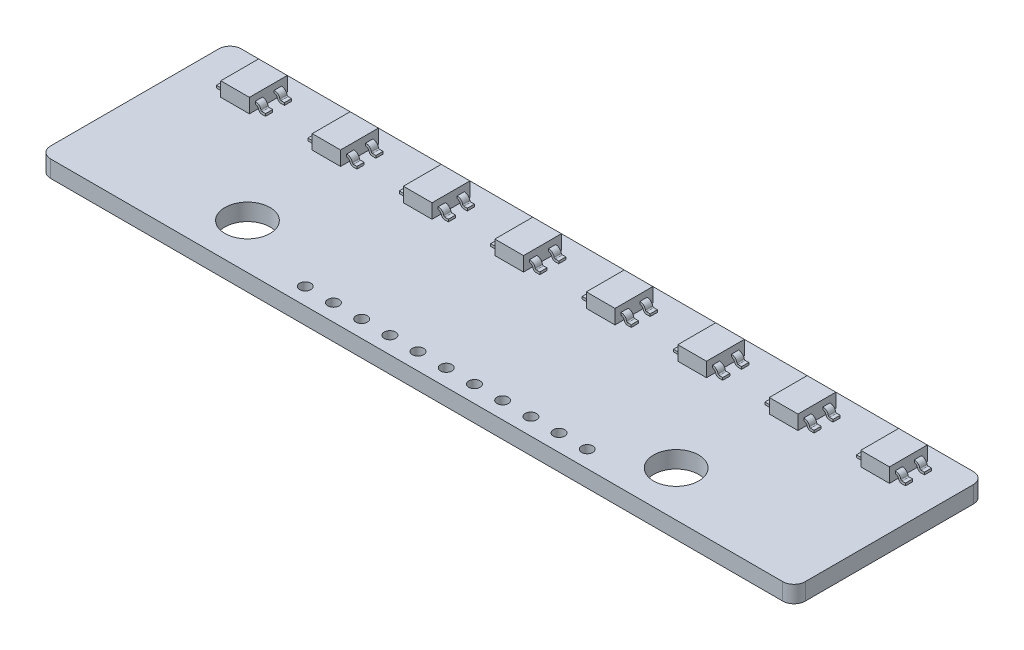
from build123d import *

# Parameters (mm, degrees)
SKETCH_1_R                     = 2
SKETCH_1_R_2                   = 0.5
EXTRUDE_1_DEPTH                = 0.75
SKETCH_4_W                     = 2.54
SKETCH_4_H                     = 3.36
EXTRUDE_2_DEPTH                = 1.27
SKETCH_4_W_2                   = 2.51
EXTRUDE_2_2_DEPTH              = 1.27
EXTRUDE_2_3_DEPTH              = 1.27
EXTRUDE_2_4_DEPTH              = 1.27
EXTRUDE_2_5_DEPTH              = 1.27
EXTRUDE_2_6_DEPTH              = 1.27
EXTRUDE_2_7_DEPTH              = 1.27
EXTRUDE_2_8_DEPTH              = 1.27
EXTRUDE_3_DEPTH                = 0.3175
EXTRUDE_3_2_DEPTH              = 0.3175
PATTERN_LINEAR_3_COUNT         = 8
PATTERN_LINEAR_3_PITCH         = 8.105
PATTERN_LINEAR_3_COPY_1_DEPTH  = 0.3175
PATTERN_LINEAR_3_COPY_2_DEPTH  = 0.3175
PATTERN_LINEAR_3_COPY_3_DEPTH  = 0.3175
PATTERN_LINEAR_3_COPY_4_DEPTH  = 0.3175
PATTERN_LINEAR_3_COPY_5_DEPTH  = 0.3175
PATTERN_LINEAR_3_COPY_6_DEPTH  = 0.3175
PATTERN_LINEAR_3_COPY_7_DEPTH  = 0.3175
PATTERN_LINEAR_3_COPY_8_DEPTH  = 0.3175
PATTERN_LINEAR_3_COPY_9_DEPTH  = 0.3175
PATTERN_LINEAR_3_COPY_10_DEPTH = 0.3175
PATTERN_LINEAR_3_COPY_11_DEPTH = 0.3175
PATTERN_LINEAR_3_COPY_12_DEPTH = 0.3175
PATTERN_LINEAR_3_COPY_13_DEPTH = 0.3175
PATTERN_LINEAR_3_COPY_14_DEPTH = 0.3175
PATTERN_LINEAR_3_COPY_15_DEPTH = 0.3175
PATTERN_LINEAR_3_COPY_16_DEPTH = 0.3175
PATTERN_LINEAR_3_COPY_17_DEPTH = 0.3175
PATTERN_LINEAR_3_COPY_18_DEPTH = 0.3175
PATTERN_LINEAR_3_COPY_19_DEPTH = 0.3175
PATTERN_LINEAR_3_COPY_20_DEPTH = 0.3175
PATTERN_LINEAR_3_COPY_21_DEPTH = 0.3175


with BuildPart() as part:
    # Эскиз1 → Бобышка-Вытянуть1 (new, symmetric)
    with BuildSketch(Plane(origin=(0, 0, 0), x_dir=(1, 0, 0), z_dir=(0, 1, 0))):
        with BuildLine():
            Line((32.45, -8.45), (-32.45, -8.45))
            ThreePointArc((-32.45, -8.45), (-33.157106781, -8.157106781), (-33.45, -7.45))
            Line((-33.45, -7.45), (-33.45, 7.45))
            ThreePointArc((-33.45, 7.45), (-33.157106781, 8.157106781), (-32.45, 8.45))
            Line((-32.45, 8.45), (32.45, 8.45))
            ThreePointArc((32.45, 8.45), (33.157106781, 8.157106781), (33.45, 7.45))
            Line((33.45, 7.45), (33.45, -7.45))
            ThreePointArc((33.45, -7.45), (33.157106781, -8.157106781), (32.45, -8.45))
        make_face()
        with Locations(Location((-19, -4.45, 0), (0, 0, 270))):
            Circle(SKETCH_1_R, mode=Mode.SUBTRACT)
        with Locations(Location((19, -4.45, 0), (0, 0, 270))):
            Circle(SKETCH_1_R, mode=Mode.SUBTRACT)
        with Locations(Location((-11.378949596, -6.95, 0), (0, 0, 270))):
            Circle(SKETCH_1_R_2, mode=Mode.SUBTRACT)
        with Locations(Location((-8.878949596, -6.95, 0), (0, 0, 270))):
            Circle(SKETCH_1_R_2, mode=Mode.SUBTRACT)
        with Locations(Location((-6.378949596, -6.95, 0), (0, 0, 270))):
            Circle(SKETCH_1_R_2, mode=Mode.SUBTRACT)
        with Locations(Location((-3.878949596, -6.95, 0), (0, 0, 270))):
            Circle(SKETCH_1_R_2, mode=Mode.SUBTRACT)
        with Locations(Location((-1.378949596, -6.95, 0), (0, 0, 270))):
            Circle(SKETCH_1_R_2, mode=Mode.SUBTRACT)
        with Locations(Location((1.121050404, -6.95, 0), (0, 0, 270))):
            Circle(SKETCH_1_R_2, mode=Mode.SUBTRACT)
        with Locations(Location((3.621050404, -6.95, 0), (0, 0, 270))):
            Circle(SKETCH_1_R_2, mode=Mode.SUBTRACT)
        with Locations(Location((6.121050404, -6.95, 0), (0, 0, 270))):
            Circle(SKETCH_1_R_2, mode=Mode.SUBTRACT)
        with Locations(Location((8.621050404, -6.95, 0), (0, 0, 270))):
            Circle(SKETCH_1_R_2, mode=Mode.SUBTRACT)
        with Locations(Location((11.121050404, -6.95, 0), (0, 0, 270))):
            Circle(SKETCH_1_R_2, mode=Mode.SUBTRACT)
        with Locations(Location((13.621050404, -6.95, 0), (0, 0, 270))):
            Circle(SKETCH_1_R_2, mode=Mode.SUBTRACT)
    extrude(amount=EXTRUDE_1_DEPTH, both=True)


with BuildPart() as body_2:
    # Эскиз4 → Бобышка-Вытянуть2 (new body)
    with BuildSketch(Plane(origin=(0, 0.75, 0), x_dir=(1, 0, 0), z_dir=(0, 1, 0))):
        with Locations((-28.37, 5.5)):
            Rectangle(SKETCH_4_W, SKETCH_4_H)
    extrude(amount=EXTRUDE_2_DEPTH)


with BuildPart() as body_3:
    # Эскиз4 → Extrude 2 2 (new body)
    with BuildSketch(Plane(origin=(0, 0.75, 0), x_dir=(1, 0, 0), z_dir=(0, 1, 0))):
        with Locations((-20.275, 5.5)):
            Rectangle(SKETCH_4_W_2, SKETCH_4_H)
    extrude(amount=EXTRUDE_2_2_DEPTH)


with BuildPart() as body_4:
    # Эскиз4 → Extrude 2 3 (new body)
    with BuildSketch(Plane(origin=(0, 0.75, 0), x_dir=(1, 0, 0), z_dir=(0, 1, 0))):
        with Locations((-12.18, 5.5)):
            Rectangle(SKETCH_4_W, SKETCH_4_H)
    extrude(amount=EXTRUDE_2_3_DEPTH)


with BuildPart() as body_5:
    # Эскиз4 → Extrude 2 4 (new body)
    with BuildSketch(Plane(origin=(0, 0.75, 0), x_dir=(1, 0, 0), z_dir=(0, 1, 0))):
        with Locations((-4.07, 5.5)):
            Rectangle(SKETCH_4_W, SKETCH_4_H)
    extrude(amount=EXTRUDE_2_4_DEPTH)


with BuildPart() as body_6:
    # Эскиз4 → Extrude 2 5 (new body)
    with BuildSketch(Plane(origin=(0, 0.75, 0), x_dir=(1, 0, 0), z_dir=(0, 1, 0))):
        with Locations((4.04, 5.5)):
            Rectangle(SKETCH_4_W, SKETCH_4_H)
    extrude(amount=EXTRUDE_2_5_DEPTH)


with BuildPart() as body_7:
    # Эскиз4 → Extrude 2 6 (new body)
    with BuildSketch(Plane(origin=(0, 0.75, 0), x_dir=(1, 0, 0), z_dir=(0, 1, 0))):
        with Locations((12.15, 5.5)):
            Rectangle(SKETCH_4_W, SKETCH_4_H)
    extrude(amount=EXTRUDE_2_6_DEPTH)


with BuildPart() as body_8:
    # Эскиз4 → Extrude 2 7 (new body)
    with BuildSketch(Plane(origin=(0, 0.75, 0), x_dir=(1, 0, 0), z_dir=(0, 1, 0))):
        with Locations((20.26, 5.5)):
            Rectangle(SKETCH_4_W, SKETCH_4_H)
    extrude(amount=EXTRUDE_2_7_DEPTH)


with BuildPart() as body_9:
    # Эскиз4 → Extrude 2 8 (new body)
    with BuildSketch(Plane(origin=(0, 0.75, 0), x_dir=(1, 0, 0), z_dir=(0, 1, 0))):
        with Locations((28.37, 5.5)):
            Rectangle(SKETCH_4_W, SKETCH_4_H)
    extrude(amount=EXTRUDE_2_8_DEPTH)


with BuildPart() as body_10:
    # Эскиз5 → Бобышка-Вытянуть3 (new, symmetric)
    with BuildSketch(Plane(origin=(0, 0, -6.34), x_dir=(-1, 0, 0), z_dir=(0, 0, -1))):
        with BuildLine():
            Line((29.64, 1.458292125), (29.64, 1.25))
            ThreePointArc((29.64, 1.25), (29.826821836, 1.163474695), (29.932521974, 0.986792755))
            ThreePointArc((29.932521974, 0.986792755), (30.042505646, 0.816264572), (30.234300526, 0.75))
            Line((30.234300526, 0.75), (30.547186473, 0.75))
            Line((30.547186473, 0.75), (30.547186473, 0.96))
            Line((30.547186473, 0.96), (30.234300526, 0.96))
            ThreePointArc((30.234300526, 0.96), (30.169603768, 0.983533756), (30.135147702, 1.043134827))
            ThreePointArc((30.135147702, 1.043134827), (29.96308158, 1.340769651), (29.64, 1.458292125))
        make_face()
    extrude_3 = extrude(amount=EXTRUDE_3_DEPTH, both=True)


with BuildPart() as body_11:
    # Эскиз5 → Extrude 3 2 (new, symmetric)
    with BuildSketch(Plane(origin=(0, 0, -6.34), x_dir=(-1, 0, 0), z_dir=(0, 0, -1))):
        with BuildLine():
            Line((26.192813527, 0.96), (26.505699474, 0.96))
            ThreePointArc((26.505699474, 0.96), (26.570396232, 0.983533756), (26.604852298, 1.043134827))
            ThreePointArc((26.604852298, 1.043134827), (26.77691842, 1.340769651), (27.1, 1.458292125))
            Line((27.1, 1.458292125), (27.1, 1.25))
            ThreePointArc((27.1, 1.25), (26.913178164, 1.163474695), (26.807478026, 0.986792755))
            ThreePointArc((26.807478026, 0.986792755), (26.697494354, 0.816264572), (26.505699474, 0.75))
            Line((26.505699474, 0.75), (26.192813527, 0.75))
            Line((26.192813527, 0.75), (26.192813527, 0.96))
        make_face()
    extrude_3_2 = extrude(amount=EXTRUDE_3_2_DEPTH, both=True)


with BuildPart() as part_1:
    add(part.part)

    add(body_2.part)  # Зеркальное отражение1 merges body 2
    # Зеркальное отражение1: Бобышка-Вытянуть3, Extrude 3 2 across plane
    add(extrude_3.mirror(Plane(origin=(0, 0, -5.5), x_dir=(1, 0, 0), z_dir=(0, 0, -1))))
    add(extrude_3_2.mirror(Plane(origin=(0, 0, -5.5), x_dir=(1, 0, 0), z_dir=(0, 0, -1))))

    add(body_4.part)  # Линейный массив3 merges body 4

    add(body_5.part)  # Линейный массив3 merges body 5

    add(body_6.part)  # Линейный массив3 merges body 6

    add(body_7.part)  # Линейный массив3 merges body 7

    add(body_8.part)  # Линейный массив3 merges body 8

    add(body_9.part)  # Линейный массив3 merges body 9
    # Линейный массив3: Бобышка-Вытянуть3, Extrude 3 2 ×8
    with Locations(*[(i * PATTERN_LINEAR_3_PITCH, 0, 0) for i in range(1, PATTERN_LINEAR_3_COUNT)]):
        add(extrude_3)
        add(extrude_3_2)

    # Линейный массив3 copy 1 sketch → Линейный массив3 copy 1 (add, symmetric)
    with BuildSketch(Plane(origin=(8.105, 0, -4.66), x_dir=(-1, 0, 0), z_dir=(0, 0, 1))):
        with BuildLine():
            Line((29.64, -1.458292125), (29.64, -1.25))
            ThreePointArc((29.64, -1.25), (29.826821836, -1.163474695), (29.932521974, -0.986792755))
            ThreePointArc((29.932521974, -0.986792755), (30.042505646, -0.816264572), (30.234300526, -0.75))
            Line((30.234300526, -0.75), (30.547186473, -0.75))
            Line((30.547186473, -0.75), (30.547186473, -0.96))
            Line((30.547186473, -0.96), (30.234300526, -0.96))
            ThreePointArc((30.234300526, -0.96), (30.169603768, -0.983533756), (30.135147702, -1.043134827))
            ThreePointArc((30.135147702, -1.043134827), (29.96308158, -1.340769651), (29.64, -1.458292125))
        make_face()
    extrude(amount=PATTERN_LINEAR_3_COPY_1_DEPTH, both=True)

    # Линейный массив3 copy 2 sketch → Линейный массив3 copy 2 (add, symmetric)
    with BuildSketch(Plane(origin=(16.21, 0, -4.66), x_dir=(-1, 0, 0), z_dir=(0, 0, 1))):
        with BuildLine():
            Line((29.64, -1.458292125), (29.64, -1.25))
            ThreePointArc((29.64, -1.25), (29.826821836, -1.163474695), (29.932521974, -0.986792755))
            ThreePointArc((29.932521974, -0.986792755), (30.042505646, -0.816264572), (30.234300526, -0.75))
            Line((30.234300526, -0.75), (30.547186473, -0.75))
            Line((30.547186473, -0.75), (30.547186473, -0.96))
            Line((30.547186473, -0.96), (30.234300526, -0.96))
            ThreePointArc((30.234300526, -0.96), (30.169603768, -0.983533756), (30.135147702, -1.043134827))
            ThreePointArc((30.135147702, -1.043134827), (29.96308158, -1.340769651), (29.64, -1.458292125))
        make_face()
    extrude(amount=PATTERN_LINEAR_3_COPY_2_DEPTH, both=True)

    # Линейный массив3 copy 3 sketch → Линейный массив3 copy 3 (add, symmetric)
    with BuildSketch(Plane(origin=(24.315, 0, -4.66), x_dir=(-1, 0, 0), z_dir=(0, 0, 1))):
        with BuildLine():
            Line((29.64, -1.458292125), (29.64, -1.25))
            ThreePointArc((29.64, -1.25), (29.826821836, -1.163474695), (29.932521974, -0.986792755))
            ThreePointArc((29.932521974, -0.986792755), (30.042505646, -0.816264572), (30.234300526, -0.75))
            Line((30.234300526, -0.75), (30.547186473, -0.75))
            Line((30.547186473, -0.75), (30.547186473, -0.96))
            Line((30.547186473, -0.96), (30.234300526, -0.96))
            ThreePointArc((30.234300526, -0.96), (30.169603768, -0.983533756), (30.135147702, -1.043134827))
            ThreePointArc((30.135147702, -1.043134827), (29.96308158, -1.340769651), (29.64, -1.458292125))
        make_face()
    extrude(amount=PATTERN_LINEAR_3_COPY_3_DEPTH, both=True)

    # Линейный массив3 copy 4 sketch → Линейный массив3 copy 4 (add, symmetric)
    with BuildSketch(Plane(origin=(32.42, 0, -4.66), x_dir=(-1, 0, 0), z_dir=(0, 0, 1))):
        with BuildLine():
            Line((29.64, -1.458292125), (29.64, -1.25))
            ThreePointArc((29.64, -1.25), (29.826821836, -1.163474695), (29.932521974, -0.986792755))
            ThreePointArc((29.932521974, -0.986792755), (30.042505646, -0.816264572), (30.234300526, -0.75))
            Line((30.234300526, -0.75), (30.547186473, -0.75))
            Line((30.547186473, -0.75), (30.547186473, -0.96))
            Line((30.547186473, -0.96), (30.234300526, -0.96))
            ThreePointArc((30.234300526, -0.96), (30.169603768, -0.983533756), (30.135147702, -1.043134827))
            ThreePointArc((30.135147702, -1.043134827), (29.96308158, -1.340769651), (29.64, -1.458292125))
        make_face()
    extrude(amount=PATTERN_LINEAR_3_COPY_4_DEPTH, both=True)

    # Линейный массив3 copy 5 sketch → Линейный массив3 copy 5 (add, symmetric)
    with BuildSketch(Plane(origin=(40.525, 0, -4.66), x_dir=(-1, 0, 0), z_dir=(0, 0, 1))):
        with BuildLine():
            Line((29.64, -1.458292125), (29.64, -1.25))
            ThreePointArc((29.64, -1.25), (29.826821836, -1.163474695), (29.932521974, -0.986792755))
            ThreePointArc((29.932521974, -0.986792755), (30.042505646, -0.816264572), (30.234300526, -0.75))
            Line((30.234300526, -0.75), (30.547186473, -0.75))
            Line((30.547186473, -0.75), (30.547186473, -0.96))
            Line((30.547186473, -0.96), (30.234300526, -0.96))
            ThreePointArc((30.234300526, -0.96), (30.169603768, -0.983533756), (30.135147702, -1.043134827))
            ThreePointArc((30.135147702, -1.043134827), (29.96308158, -1.340769651), (29.64, -1.458292125))
        make_face()
    extrude(amount=PATTERN_LINEAR_3_COPY_5_DEPTH, both=True)

    # Линейный массив3 copy 6 sketch → Линейный массив3 copy 6 (add, symmetric)
    with BuildSketch(Plane(origin=(48.63, 0, -4.66), x_dir=(-1, 0, 0), z_dir=(0, 0, 1))):
        with BuildLine():
            Line((29.64, -1.458292125), (29.64, -1.25))
            ThreePointArc((29.64, -1.25), (29.826821836, -1.163474695), (29.932521974, -0.986792755))
            ThreePointArc((29.932521974, -0.986792755), (30.042505646, -0.816264572), (30.234300526, -0.75))
            Line((30.234300526, -0.75), (30.547186473, -0.75))
            Line((30.547186473, -0.75), (30.547186473, -0.96))
            Line((30.547186473, -0.96), (30.234300526, -0.96))
            ThreePointArc((30.234300526, -0.96), (30.169603768, -0.983533756), (30.135147702, -1.043134827))
            ThreePointArc((30.135147702, -1.043134827), (29.96308158, -1.340769651), (29.64, -1.458292125))
        make_face()
    extrude(amount=PATTERN_LINEAR_3_COPY_6_DEPTH, both=True)

    # Линейный массив3 copy 7 sketch → Линейный массив3 copy 7 (add, symmetric)
    with BuildSketch(Plane(origin=(56.735, 0, -4.66), x_dir=(-1, 0, 0), z_dir=(0, 0, 1))):
        with BuildLine():
            Line((29.64, -1.458292125), (29.64, -1.25))
            ThreePointArc((29.64, -1.25), (29.826821836, -1.163474695), (29.932521974, -0.986792755))
            ThreePointArc((29.932521974, -0.986792755), (30.042505646, -0.816264572), (30.234300526, -0.75))
            Line((30.234300526, -0.75), (30.547186473, -0.75))
            Line((30.547186473, -0.75), (30.547186473, -0.96))
            Line((30.547186473, -0.96), (30.234300526, -0.96))
            ThreePointArc((30.234300526, -0.96), (30.169603768, -0.983533756), (30.135147702, -1.043134827))
            ThreePointArc((30.135147702, -1.043134827), (29.96308158, -1.340769651), (29.64, -1.458292125))
        make_face()
    extrude(amount=PATTERN_LINEAR_3_COPY_7_DEPTH, both=True)

    # Линейный массив3 copy 8 sketch → Линейный массив3 copy 8 (add, symmetric)
    with BuildSketch(Plane(origin=(8.105, 0, -4.66), x_dir=(-1, 0, 0), z_dir=(0, 0, 1))):
        with BuildLine():
            Line((26.192813527, -0.96), (26.505699474, -0.96))
            ThreePointArc((26.505699474, -0.96), (26.570396232, -0.983533756), (26.604852298, -1.043134827))
            ThreePointArc((26.604852298, -1.043134827), (26.77691842, -1.340769651), (27.1, -1.458292125))
            Line((27.1, -1.458292125), (27.1, -1.25))
            ThreePointArc((27.1, -1.25), (26.913178164, -1.163474695), (26.807478026, -0.986792755))
            ThreePointArc((26.807478026, -0.986792755), (26.697494354, -0.816264572), (26.505699474, -0.75))
            Line((26.505699474, -0.75), (26.192813527, -0.75))
            Line((26.192813527, -0.75), (26.192813527, -0.96))
        make_face()
    extrude(amount=PATTERN_LINEAR_3_COPY_8_DEPTH, both=True)

    # Линейный массив3 copy 9 sketch → Линейный массив3 copy 9 (add, symmetric)
    with BuildSketch(Plane(origin=(16.21, 0, -4.66), x_dir=(-1, 0, 0), z_dir=(0, 0, 1))):
        with BuildLine():
            Line((26.192813527, -0.96), (26.505699474, -0.96))
            ThreePointArc((26.505699474, -0.96), (26.570396232, -0.983533756), (26.604852298, -1.043134827))
            ThreePointArc((26.604852298, -1.043134827), (26.77691842, -1.340769651), (27.1, -1.458292125))
            Line((27.1, -1.458292125), (27.1, -1.25))
            ThreePointArc((27.1, -1.25), (26.913178164, -1.163474695), (26.807478026, -0.986792755))
            ThreePointArc((26.807478026, -0.986792755), (26.697494354, -0.816264572), (26.505699474, -0.75))
            Line((26.505699474, -0.75), (26.192813527, -0.75))
            Line((26.192813527, -0.75), (26.192813527, -0.96))
        make_face()
    extrude(amount=PATTERN_LINEAR_3_COPY_9_DEPTH, both=True)

    # Линейный массив3 copy 10 sketch → Линейный массив3 copy 10 (add, symmetric)
    with BuildSketch(Plane(origin=(24.315, 0, -4.66), x_dir=(-1, 0, 0), z_dir=(0, 0, 1))):
        with BuildLine():
            Line((26.192813527, -0.96), (26.505699474, -0.96))
            ThreePointArc((26.505699474, -0.96), (26.570396232, -0.983533756), (26.604852298, -1.043134827))
            ThreePointArc((26.604852298, -1.043134827), (26.77691842, -1.340769651), (27.1, -1.458292125))
            Line((27.1, -1.458292125), (27.1, -1.25))
            ThreePointArc((27.1, -1.25), (26.913178164, -1.163474695), (26.807478026, -0.986792755))
            ThreePointArc((26.807478026, -0.986792755), (26.697494354, -0.816264572), (26.505699474, -0.75))
            Line((26.505699474, -0.75), (26.192813527, -0.75))
            Line((26.192813527, -0.75), (26.192813527, -0.96))
        make_face()
    extrude(amount=PATTERN_LINEAR_3_COPY_10_DEPTH, both=True)

    # Линейный массив3 copy 11 sketch → Линейный массив3 copy 11 (add, symmetric)
    with BuildSketch(Plane(origin=(32.42, 0, -4.66), x_dir=(-1, 0, 0), z_dir=(0, 0, 1))):
        with BuildLine():
            Line((26.192813527, -0.96), (26.505699474, -0.96))
            ThreePointArc((26.505699474, -0.96), (26.570396232, -0.983533756), (26.604852298, -1.043134827))
            ThreePointArc((26.604852298, -1.043134827), (26.77691842, -1.340769651), (27.1, -1.458292125))
            Line((27.1, -1.458292125), (27.1, -1.25))
            ThreePointArc((27.1, -1.25), (26.913178164, -1.163474695), (26.807478026, -0.986792755))
            ThreePointArc((26.807478026, -0.986792755), (26.697494354, -0.816264572), (26.505699474, -0.75))
            Line((26.505699474, -0.75), (26.192813527, -0.75))
            Line((26.192813527, -0.75), (26.192813527, -0.96))
        make_face()
    extrude(amount=PATTERN_LINEAR_3_COPY_11_DEPTH, both=True)

    # Линейный массив3 copy 12 sketch → Линейный массив3 copy 12 (add, symmetric)
    with BuildSketch(Plane(origin=(40.525, 0, -4.66), x_dir=(-1, 0, 0), z_dir=(0, 0, 1))):
        with BuildLine():
            Line((26.192813527, -0.96), (26.505699474, -0.96))
            ThreePointArc((26.505699474, -0.96), (26.570396232, -0.983533756), (26.604852298, -1.043134827))
            ThreePointArc((26.604852298, -1.043134827), (26.77691842, -1.340769651), (27.1, -1.458292125))
            Line((27.1, -1.458292125), (27.1, -1.25))
            ThreePointArc((27.1, -1.25), (26.913178164, -1.163474695), (26.807478026, -0.986792755))
            ThreePointArc((26.807478026, -0.986792755), (26.697494354, -0.816264572), (26.505699474, -0.75))
            Line((26.505699474, -0.75), (26.192813527, -0.75))
            Line((26.192813527, -0.75), (26.192813527, -0.96))
        make_face()
    extrude(amount=PATTERN_LINEAR_3_COPY_12_DEPTH, both=True)

    # Линейный массив3 copy 13 sketch → Линейный массив3 copy 13 (add, symmetric)
    with BuildSketch(Plane(origin=(48.63, 0, -4.66), x_dir=(-1, 0, 0), z_dir=(0, 0, 1))):
        with BuildLine():
            Line((26.192813527, -0.96), (26.505699474, -0.96))
            ThreePointArc((26.505699474, -0.96), (26.570396232, -0.983533756), (26.604852298, -1.043134827))
            ThreePointArc((26.604852298, -1.043134827), (26.77691842, -1.340769651), (27.1, -1.458292125))
            Line((27.1, -1.458292125), (27.1, -1.25))
            ThreePointArc((27.1, -1.25), (26.913178164, -1.163474695), (26.807478026, -0.986792755))
            ThreePointArc((26.807478026, -0.986792755), (26.697494354, -0.816264572), (26.505699474, -0.75))
            Line((26.505699474, -0.75), (26.192813527, -0.75))
            Line((26.192813527, -0.75), (26.192813527, -0.96))
        make_face()
    extrude(amount=PATTERN_LINEAR_3_COPY_13_DEPTH, both=True)

    # Линейный массив3 copy 14 sketch → Линейный массив3 copy 14 (add, symmetric)
    with BuildSketch(Plane(origin=(56.735, 0, -4.66), x_dir=(-1, 0, 0), z_dir=(0, 0, 1))):
        with BuildLine():
            Line((26.192813527, -0.96), (26.505699474, -0.96))
            ThreePointArc((26.505699474, -0.96), (26.570396232, -0.983533756), (26.604852298, -1.043134827))
            ThreePointArc((26.604852298, -1.043134827), (26.77691842, -1.340769651), (27.1, -1.458292125))
            Line((27.1, -1.458292125), (27.1, -1.25))
            ThreePointArc((27.1, -1.25), (26.913178164, -1.163474695), (26.807478026, -0.986792755))
            ThreePointArc((26.807478026, -0.986792755), (26.697494354, -0.816264572), (26.505699474, -0.75))
            Line((26.505699474, -0.75), (26.192813527, -0.75))
            Line((26.192813527, -0.75), (26.192813527, -0.96))
        make_face()
    extrude(amount=PATTERN_LINEAR_3_COPY_14_DEPTH, both=True)

    # Линейный массив3 copy 15 sketch → Линейный массив3 copy 15 (add, symmetric)
    with BuildSketch(Plane(origin=(8.105, 0, -6.34), x_dir=(-1, 0, 0), z_dir=(0, 0, -1))):
        with BuildLine():
            Line((26.192813527, 0.96), (26.505699474, 0.96))
            ThreePointArc((26.505699474, 0.96), (26.570396232, 0.983533756), (26.604852298, 1.043134827))
            ThreePointArc((26.604852298, 1.043134827), (26.77691842, 1.340769651), (27.1, 1.458292125))
            Line((27.1, 1.458292125), (27.1, 1.25))
            ThreePointArc((27.1, 1.25), (26.913178164, 1.163474695), (26.807478026, 0.986792755))
            ThreePointArc((26.807478026, 0.986792755), (26.697494354, 0.816264572), (26.505699474, 0.75))
            Line((26.505699474, 0.75), (26.192813527, 0.75))
            Line((26.192813527, 0.75), (26.192813527, 0.96))
        make_face()
    extrude(amount=PATTERN_LINEAR_3_COPY_15_DEPTH, both=True)

    # Линейный массив3 copy 16 sketch → Линейный массив3 copy 16 (add, symmetric)
    with BuildSketch(Plane(origin=(16.21, 0, -6.34), x_dir=(-1, 0, 0), z_dir=(0, 0, -1))):
        with BuildLine():
            Line((26.192813527, 0.96), (26.505699474, 0.96))
            ThreePointArc((26.505699474, 0.96), (26.570396232, 0.983533756), (26.604852298, 1.043134827))
            ThreePointArc((26.604852298, 1.043134827), (26.77691842, 1.340769651), (27.1, 1.458292125))
            Line((27.1, 1.458292125), (27.1, 1.25))
            ThreePointArc((27.1, 1.25), (26.913178164, 1.163474695), (26.807478026, 0.986792755))
            ThreePointArc((26.807478026, 0.986792755), (26.697494354, 0.816264572), (26.505699474, 0.75))
            Line((26.505699474, 0.75), (26.192813527, 0.75))
            Line((26.192813527, 0.75), (26.192813527, 0.96))
        make_face()
    extrude(amount=PATTERN_LINEAR_3_COPY_16_DEPTH, both=True)

    # Линейный массив3 copy 17 sketch → Линейный массив3 copy 17 (add, symmetric)
    with BuildSketch(Plane(origin=(24.315, 0, -6.34), x_dir=(-1, 0, 0), z_dir=(0, 0, -1))):
        with BuildLine():
            Line((26.192813527, 0.96), (26.505699474, 0.96))
            ThreePointArc((26.505699474, 0.96), (26.570396232, 0.983533756), (26.604852298, 1.043134827))
            ThreePointArc((26.604852298, 1.043134827), (26.77691842, 1.340769651), (27.1, 1.458292125))
            Line((27.1, 1.458292125), (27.1, 1.25))
            ThreePointArc((27.1, 1.25), (26.913178164, 1.163474695), (26.807478026, 0.986792755))
            ThreePointArc((26.807478026, 0.986792755), (26.697494354, 0.816264572), (26.505699474, 0.75))
            Line((26.505699474, 0.75), (26.192813527, 0.75))
            Line((26.192813527, 0.75), (26.192813527, 0.96))
        make_face()
    extrude(amount=PATTERN_LINEAR_3_COPY_17_DEPTH, both=True)

    # Линейный массив3 copy 18 sketch → Линейный массив3 copy 18 (add, symmetric)
    with BuildSketch(Plane(origin=(32.42, 0, -6.34), x_dir=(-1, 0, 0), z_dir=(0, 0, -1))):
        with BuildLine():
            Line((26.192813527, 0.96), (26.505699474, 0.96))
            ThreePointArc((26.505699474, 0.96), (26.570396232, 0.983533756), (26.604852298, 1.043134827))
            ThreePointArc((26.604852298, 1.043134827), (26.77691842, 1.340769651), (27.1, 1.458292125))
            Line((27.1, 1.458292125), (27.1, 1.25))
            ThreePointArc((27.1, 1.25), (26.913178164, 1.163474695), (26.807478026, 0.986792755))
            ThreePointArc((26.807478026, 0.986792755), (26.697494354, 0.816264572), (26.505699474, 0.75))
            Line((26.505699474, 0.75), (26.192813527, 0.75))
            Line((26.192813527, 0.75), (26.192813527, 0.96))
        make_face()
    extrude(amount=PATTERN_LINEAR_3_COPY_18_DEPTH, both=True)

    # Линейный массив3 copy 19 sketch → Линейный массив3 copy 19 (add, symmetric)
    with BuildSketch(Plane(origin=(40.525, 0, -6.34), x_dir=(-1, 0, 0), z_dir=(0, 0, -1))):
        with BuildLine():
            Line((26.192813527, 0.96), (26.505699474, 0.96))
            ThreePointArc((26.505699474, 0.96), (26.570396232, 0.983533756), (26.604852298, 1.043134827))
            ThreePointArc((26.604852298, 1.043134827), (26.77691842, 1.340769651), (27.1, 1.458292125))
            Line((27.1, 1.458292125), (27.1, 1.25))
            ThreePointArc((27.1, 1.25), (26.913178164, 1.163474695), (26.807478026, 0.986792755))
            ThreePointArc((26.807478026, 0.986792755), (26.697494354, 0.816264572), (26.505699474, 0.75))
            Line((26.505699474, 0.75), (26.192813527, 0.75))
            Line((26.192813527, 0.75), (26.192813527, 0.96))
        make_face()
    extrude(amount=PATTERN_LINEAR_3_COPY_19_DEPTH, both=True)

    # Линейный массив3 copy 20 sketch → Линейный массив3 copy 20 (add, symmetric)
    with BuildSketch(Plane(origin=(48.63, 0, -6.34), x_dir=(-1, 0, 0), z_dir=(0, 0, -1))):
        with BuildLine():
            Line((26.192813527, 0.96), (26.505699474, 0.96))
            ThreePointArc((26.505699474, 0.96), (26.570396232, 0.983533756), (26.604852298, 1.043134827))
            ThreePointArc((26.604852298, 1.043134827), (26.77691842, 1.340769651), (27.1, 1.458292125))
            Line((27.1, 1.458292125), (27.1, 1.25))
            ThreePointArc((27.1, 1.25), (26.913178164, 1.163474695), (26.807478026, 0.986792755))
            ThreePointArc((26.807478026, 0.986792755), (26.697494354, 0.816264572), (26.505699474, 0.75))
            Line((26.505699474, 0.75), (26.192813527, 0.75))
            Line((26.192813527, 0.75), (26.192813527, 0.96))
        make_face()
    extrude(amount=PATTERN_LINEAR_3_COPY_20_DEPTH, both=True)

    # Линейный массив3 copy 21 sketch → Линейный массив3 copy 21 (add, symmetric)
    with BuildSketch(Plane(origin=(56.735, 0, -6.34), x_dir=(-1, 0, 0), z_dir=(0, 0, -1))):
        with BuildLine():
            Line((26.192813527, 0.96), (26.505699474, 0.96))
            ThreePointArc((26.505699474, 0.96), (26.570396232, 0.983533756), (26.604852298, 1.043134827))
            ThreePointArc((26.604852298, 1.043134827), (26.77691842, 1.340769651), (27.1, 1.458292125))
            Line((27.1, 1.458292125), (27.1, 1.25))
            ThreePointArc((27.1, 1.25), (26.913178164, 1.163474695), (26.807478026, 0.986792755))
            ThreePointArc((26.807478026, 0.986792755), (26.697494354, 0.816264572), (26.505699474, 0.75))
            Line((26.505699474, 0.75), (26.192813527, 0.75))
            Line((26.192813527, 0.75), (26.192813527, 0.96))
        make_face()
    extrude(amount=PATTERN_LINEAR_3_COPY_21_DEPTH, both=True)


solid = Compound([body_3.part, body_10.part, body_11.part, part_1.part])
